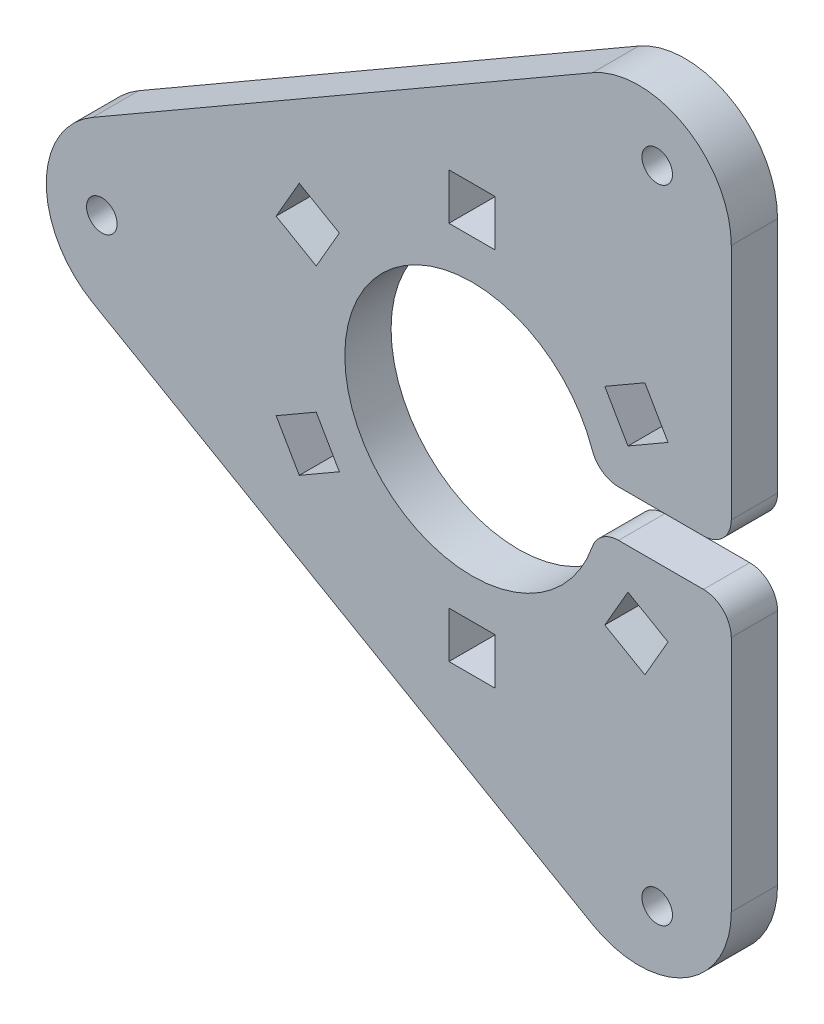
from build123d import *

# Parameters (mm, degrees)
SKETCH1_R           = 1.65
SKETCH1_W           = 5
SKETCH1_H           = 5
BOSS_EXTRUDE1_DEPTH = 5
CONG_1_R            = 10
CONG_2_R            = 3


with BuildPart() as part:
    # Sketch1 → Boss-Extrude1 (new body)
    with BuildSketch(Plane.XY):
        with BuildLine():
            Line((28, 2.5), (13.520817283, 2.5))
            ThreePointArc((13.520817283, 2.5), (-13.75, 0), (13.520817283, -2.5))
            Line((13.520817283, -2.5), (28, -2.5))
            Line((28, -2.5), (28, -48.497422612))
            Line((28, -48.497422612), (-56, 0))
            Line((-56, 0), (28, 48.497422612))
            Line((28, 48.497422612), (28, 2.5))
        make_face()
        with Locations((20, 34.641016151)):
            Circle(SKETCH1_R, mode=Mode.SUBTRACT)
        with Locations((20, -34.641016151)):
            Circle(SKETCH1_R, mode=Mode.SUBTRACT)
        with Locations((-40, 0)):
            Circle(SKETCH1_R, mode=Mode.SUBTRACT)
        with Locations((0, 20.5)):
            Rectangle(SKETCH1_W, SKETCH1_H, mode=Mode.SUBTRACT)
        Polygon((21.168584287, 9.334936491), (16.838457268, 6.834936491), (14.338457268, 11.165063509), (18.668584287, 13.665063509), align=None, mode=Mode.SUBTRACT)
        Polygon((18.668584287, -13.665063509), (14.338457268, -11.165063509), (16.838457268, -6.834936491), (21.168584287, -9.334936491), align=None, mode=Mode.SUBTRACT)
        with Locations((0, -20.5)):
            Rectangle(SKETCH1_W, SKETCH1_H, mode=Mode.SUBTRACT)
        Polygon((-21.168584287, -9.334936491), (-16.838457268, -6.834936491), (-14.338457268, -11.165063509), (-18.668584287, -13.665063509), align=None, mode=Mode.SUBTRACT)
        Polygon((-18.668584287, 13.665063509), (-14.338457268, 11.165063509), (-16.838457268, 6.834936491), (-21.168584287, 9.334936491), align=None, mode=Mode.SUBTRACT)
    extrude(amount=BOSS_EXTRUDE1_DEPTH)

    # Congé1
    cong_1_edges = [part.edges().sort_by_distance(p)[0] for p in [
        (28, -48.497422612, 2.5),
        (-56, 0, 2.5),
        (28, 48.497422612, 2.5),
    ]]
    fillet(cong_1_edges, radius=CONG_1_R)

    # Congé2
    cong_2_edges = [part.edges().sort_by_distance(p)[0] for p in [
        (28, 2.5, 2.5),
        (13.520817283, 2.5, 2.5),
        (13.520817283, -2.5, 2.5),
        (28, -2.5, 2.5),
    ]]
    fillet(cong_2_edges, radius=CONG_2_R)


solid = part.part
